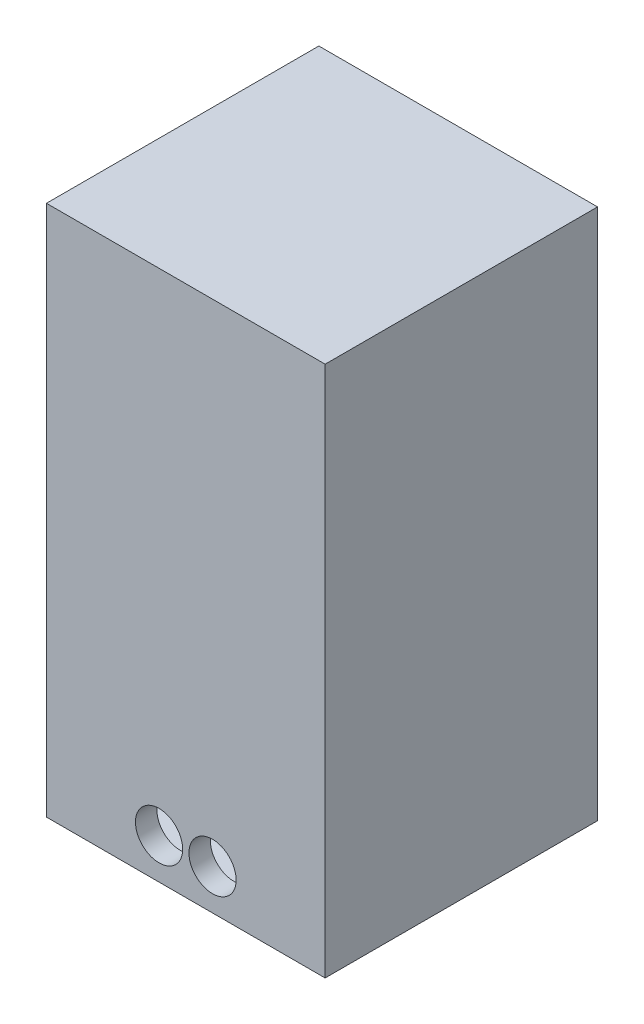
from build123d import *

# Parameters (mm, degrees)
SKETCH1_W           = 886
SKETCH1_H           = 1690
BOSS_EXTRUDE1_DEPTH = 866
SKETCH2_W           = 1640
SKETCH2_H           = 830
CUT_EXTRUDE1_DEPTH  = 850
CUT_EXTRUDE2_DEPTH  = 288
BOSS_EXTRUDE2_DEPTH = 50
HOLE1_D             = 150
HOLE1_DEPTH         = 68


with BuildPart() as part:
    # Sketch1 → Boss-Extrude1 (new body)
    with BuildSketch(Plane.XY.offset(433)):
        with Locations((0, 827)):
            Rectangle(SKETCH1_W, SKETCH1_H)
    extrude(amount=-BOSS_EXTRUDE1_DEPTH)

    # Sketch2 → Cut-Extrude1 (cut)
    with BuildSketch(Plane(origin=(-425, 0, 0), x_dir=(0, -1, 0), z_dir=(-1, 0, 0))):
        with Locations((-827, 0)):
            Rectangle(SKETCH2_W, SKETCH2_H)
    extrude(amount=-CUT_EXTRUDE1_DEPTH, mode=Mode.SUBTRACT)

    # Sketch3 → Cut-Extrude2 (cut)
    with BuildSketch(Plane(origin=(0, 0, -433), x_dir=(-1, 0, 0), z_dir=(0, 0, -1))):
        with BuildLine():
            Line((-300, 1615), (-300, 1605))
            ThreePointArc((-300, 1605), (-295.606601718, 1594.393398282), (-285, 1590))
            Line((-285, 1590), (285, 1590))
            ThreePointArc((285, 1590), (295.606601718, 1594.393398282), (300, 1605))
            Line((300, 1605), (300, 1615))
            ThreePointArc((300, 1615), (295.606601718, 1625.606601718), (285, 1630))
            Line((285, 1630), (-285, 1630))
            ThreePointArc((-285, 1630), (-295.606601718, 1625.606601718), (-300, 1615))
        make_face()
    extrude(amount=-CUT_EXTRUDE2_DEPTH, mode=Mode.SUBTRACT)

    # Sketch4 → Boss-Extrude2 (add)
    with BuildSketch(Plane(origin=(0, 0, 415), x_dir=(-1, 0, 0), z_dir=(0, 0, -1))):
        with BuildLine():
            ThreePointArc((0, 80.419601085), (-175, 110), (0, 139.580398915))
            ThreePointArc((0, 139.580398915), (175, 110), (0, 80.419601085))
        make_face()
    extrude(amount=BOSS_EXTRUDE2_DEPTH)

    # Hole1
    with Locations(Plane(origin=(0, 0, 365), x_dir=(-1, 0, 0), z_dir=(0, 0, -1))):
        with Locations((-85, 110), (85, 110)):
            Hole(HOLE1_D / 2, depth=HOLE1_DEPTH)


solid = part.part
